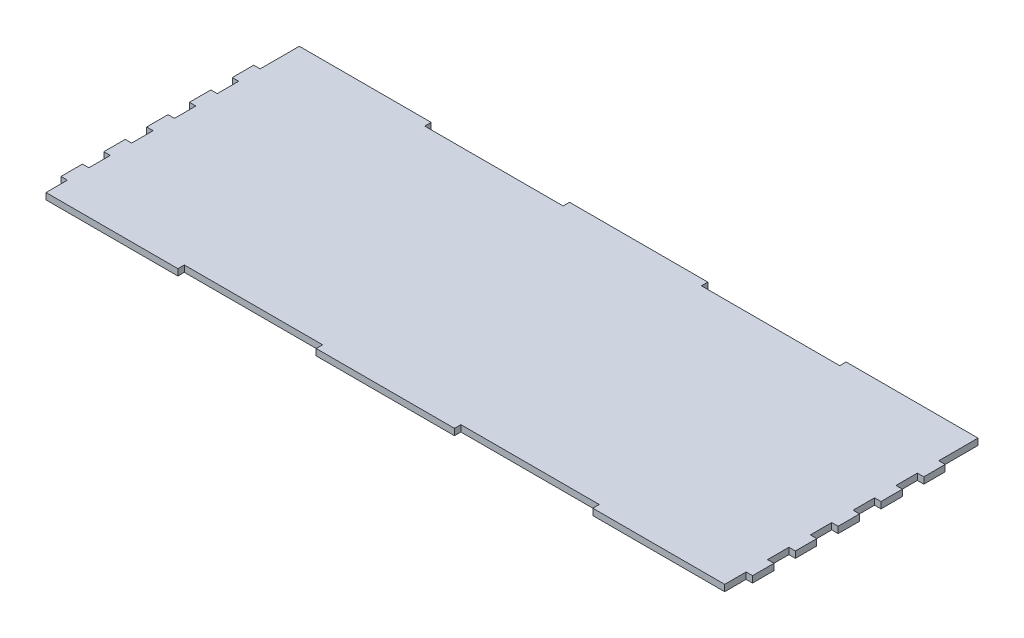
from build123d import *

# Parameters (mm, degrees)
BOSS_EXTRUDE4_DEPTH = 3


with BuildPart() as part:
    # Sketch1 → Boss-Extrude4 (new body)
    with BuildSketch(Plane(origin=(0, 0, 0), x_dir=(1, 0, 0), z_dir=(0, 1, 0))):
        Polygon((3, 0), (3, 10), (0, 10), (0, 20), (3, 20), (3, 30), (0, 30), (0, 40), (3, 40), (3, 50), (0, 50), (0, 60), (3, 60), (3, 70), (0, 70), (0, 80), (3, 80), (3, 90), (0, 90), (0, 100), (3, 100), (3, 118.32), (64.6, 118.32), (64.6, 115.32), (129.2, 115.32), (129.2, 118.32), (193.8, 118.32), (193.8, 115.32), (258.4, 115.32), (258.4, 118.32), (320, 118.32), (320, 100), (323, 100), (323, 90), (320, 90), (320, 80), (323, 80), (323, 70), (320, 70), (320, 60), (323, 60), (323, 50), (320, 50), (320, 40), (323, 40), (323, 30), (320, 30), (320, 20), (323, 20), (323, 10), (320, 10), (320, 0), (258.4, 0), (258.4, 3), (193.8, 3), (193.8, 0), (129.2, 0), (129.2, 3), (64.6, 3), (64.6, 0), align=None)
    extrude(amount=BOSS_EXTRUDE4_DEPTH)


solid = part.part
